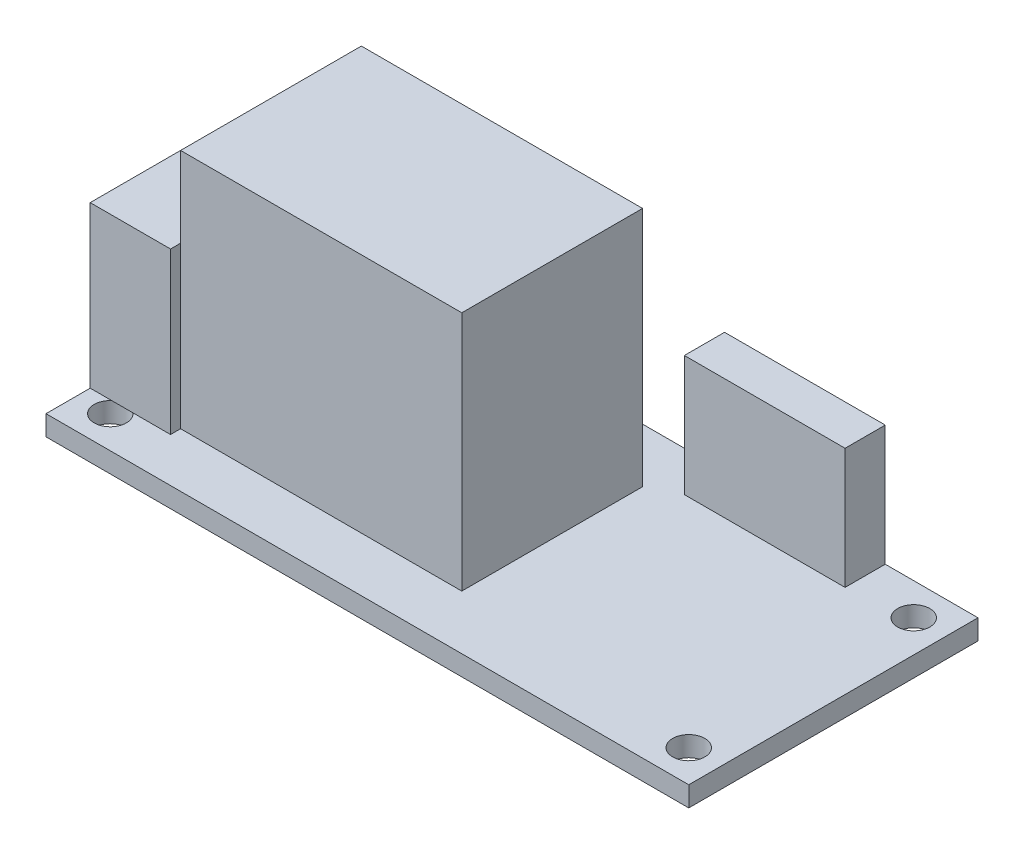
from build123d import *

# Parameters (mm, degrees)
SKETCH1_W           = 50.8
SKETCH1_H           = 22.86
BOSS_EXTRUDE1_DEPTH = 1.5875
SKETCH2_W           = 6.35
SKETCH2_H           = 15.875
BOSS_EXTRUDE2_DEPTH = 12.7
SKETCH3_W           = 22.225
SKETCH3_H           = 14.2875
BOSS_EXTRUDE3_DEPTH = 19.05
SKETCH4_W           = 12.7
SKETCH4_H           = 3.175
BOSS_EXTRUDE4_DEPTH = 9.525
SKETCH5_R           = 1.27
CUT_EXTRUDE1_DEPTH  = 34.744738849


with BuildPart() as part:
    # Sketch1 → Boss-Extrude1 (new body)
    with BuildSketch(Plane(origin=(0, 0, 0), x_dir=(1, 0, 0), z_dir=(0, 1, 0))):
        Rectangle(SKETCH1_W, SKETCH1_H)
    extrude(amount=BOSS_EXTRUDE1_DEPTH)

    # Sketch2 → Boss-Extrude2 (add)
    with BuildSketch(Plane(origin=(0, 1.5875, 0), x_dir=(1, 0, 0), z_dir=(0, 1, 0))):
        with Locations((-22.225, 0)):
            Rectangle(SKETCH2_W, SKETCH2_H)
    extrude(amount=BOSS_EXTRUDE2_DEPTH)

    # Sketch3 → Boss-Extrude3 (add)
    with BuildSketch(Plane(origin=(0, 1.5875, 0), x_dir=(1, 0, 0), z_dir=(0, 1, 0))):
        with Locations((-7.9375, 0)):
            Rectangle(SKETCH3_W, SKETCH3_H)
    extrude(amount=BOSS_EXTRUDE3_DEPTH)

    # Sketch4 → Boss-Extrude4 (add)
    with BuildSketch(Plane(origin=(0, 1.5875, 0), x_dir=(1, 0, 0), z_dir=(0, 1, 0))):
        with Locations((11.719402779, 9.8425)):
            Rectangle(SKETCH4_W, SKETCH4_H)
    extrude(amount=BOSS_EXTRUDE4_DEPTH)

    # Sketch5 → Cut-Extrude1 (cut, through all)
    with BuildSketch(Plane(origin=(0, 1.5875, 0), x_dir=(1, 0, 0), z_dir=(0, 1, 0))):
        with Locations(Location((-22.86, 8.89, 0), (0, 0, 270))):
            Circle(SKETCH5_R)
        with Locations(Location((22.86, 8.89, 0), (0, 0, 270))):
            Circle(SKETCH5_R)
        with Locations(Location((-22.86, -8.89, 0), (0, 0, 270))):
            Circle(SKETCH5_R)
        with Locations(Location((22.86, -8.89, 0), (0, 0, 270))):
            Circle(SKETCH5_R)
    extrude(amount=-CUT_EXTRUDE1_DEPTH, mode=Mode.SUBTRACT)


solid = part.part
